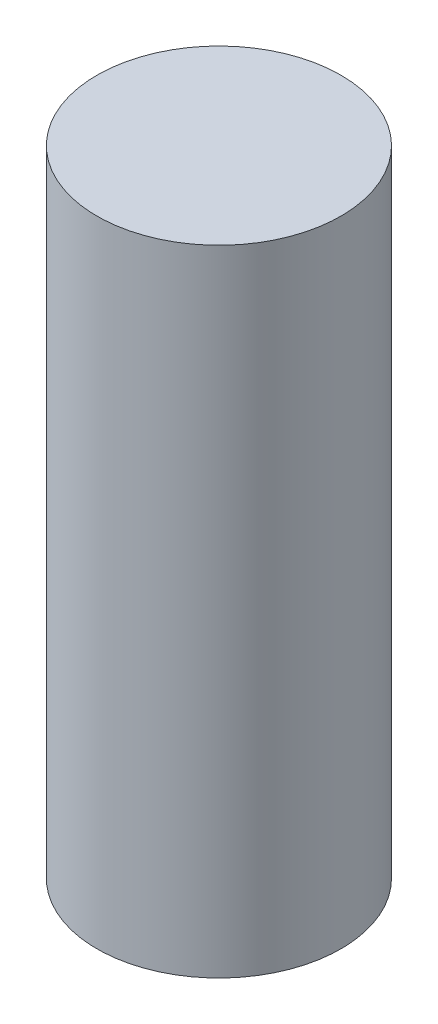
from build123d import *

# Parameters (mm, degrees)
SKETCH1_R           = 2.5
BOSS_EXTRUDE1_DEPTH = 13


with BuildPart() as part:
    # Sketch1 → Boss-Extrude1 (new body)
    with BuildSketch(Plane(origin=(0, 0, 0), x_dir=(1, 0, 0), z_dir=(0, 1, 0))):
        with Locations(Location((0, 0, 0), (0, 0, 90))):
            Circle(SKETCH1_R)
    extrude(amount=BOSS_EXTRUDE1_DEPTH)


solid = part.part
